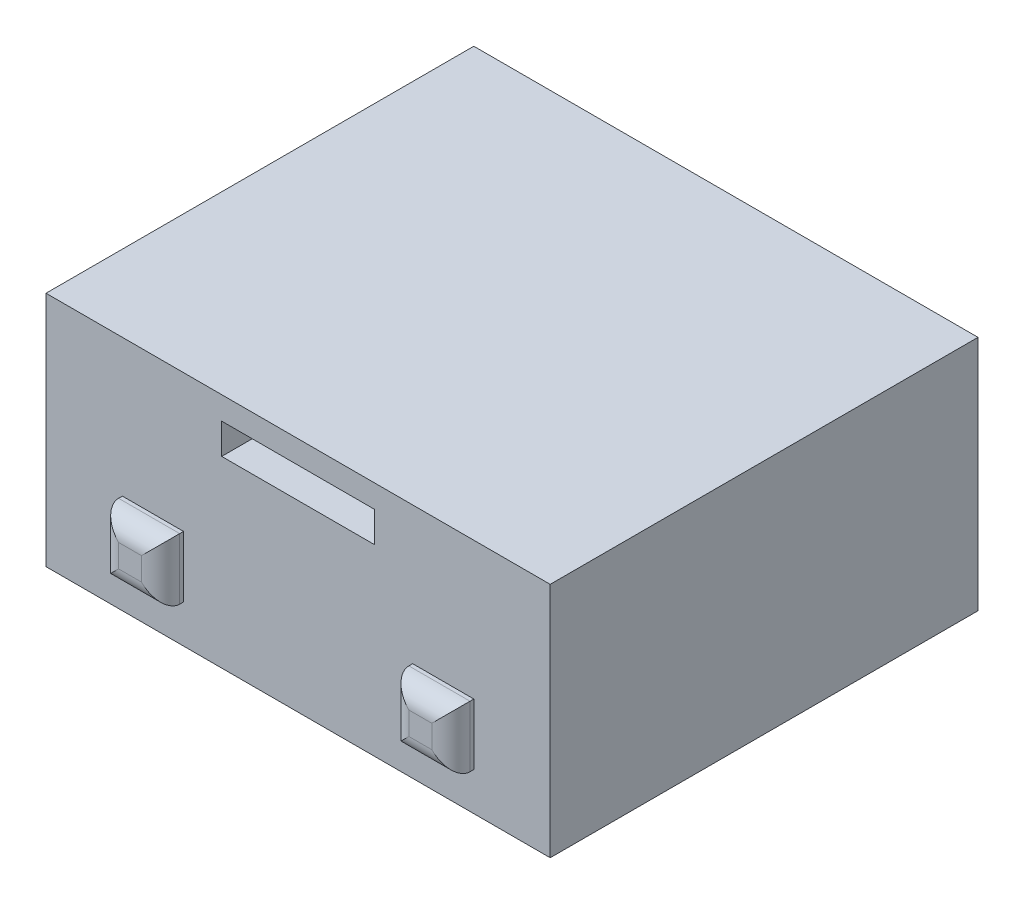
from build123d import *

# Parameters (mm, degrees)
SKETCH1_W            = 66
SKETCH1_H            = 56
BASE_DEPTH           = 3
SKETCH4_W            = 66
SKETCH4_H            = 56
SKETCH4_W_2          = 58
SKETCH4_H_2          = 48
WALL1_DEPTH          = 21
WALL2_START          = -21
SKETCH8_W            = 62
SKETCH8_H            = 52
SKETCH8_W_2          = 58
SKETCH8_H_2          = 48
WALL2_DEPTH          = 2
PCBWALL_START        = -3
SKETCH9_W            = 48
SKETCH9_H            = 38
SKETCH9_W_2          = 44
SKETCH9_H_2          = 34
PCBWALL_DEPTH        = 4
SKETCH10_R           = 1.2
MOUNTING_HOLE_DEPTH  = 4
SKETCH11_W           = 66
SKETCH11_H           = 56
EXTENDED_BASE_DEPTH  = 10
HEAD_START           = 28
SKETCH12_W           = 20
SKETCH12_H           = 4
HEAD_BAND_SLOT_DEPTH = 77.104053883
CLIPS_START          = 28
SKETCH13_W           = 8
SKETCH13_H           = 8
CLIPS_DEPTH          = 3
FILLET2_R            = 2.5


with BuildPart() as part:
    # Sketch1 → Base (new body)
    with BuildSketch(Plane(origin=(0, 0, 0), x_dir=(1, 0, 0), z_dir=(0, 1, 0))):
        Rectangle(SKETCH1_W, SKETCH1_H)
    extrude(amount=-BASE_DEPTH)

    # Sketch4 → Wall1 (add)
    with BuildSketch(Plane(origin=(0, 0, 0), x_dir=(1, 0, 0), z_dir=(0, 1, 0))):
        Rectangle(SKETCH4_W, SKETCH4_H)
        Rectangle(SKETCH4_W_2, SKETCH4_H_2, mode=Mode.SUBTRACT)
    extrude(amount=-WALL1_DEPTH)

    # Sketch8 → Wall2 (cut)
    with BuildSketch(Plane(origin=(0, 0, 0), x_dir=(1, 0, 0), z_dir=(0, 1, 0)).offset(WALL2_START)):
        Rectangle(SKETCH8_W, SKETCH8_H)
        Rectangle(SKETCH8_W_2, SKETCH8_H_2, mode=Mode.SUBTRACT)
    extrude(amount=WALL2_DEPTH, mode=Mode.SUBTRACT)

    # Sketch9 → PCBWall (add)
    with BuildSketch(Plane(origin=(0, 0, 0), x_dir=(1, 0, 0), z_dir=(0, 1, 0)).offset(PCBWALL_START)):
        Rectangle(SKETCH9_W, SKETCH9_H)
        Rectangle(SKETCH9_W_2, SKETCH9_H_2, mode=Mode.SUBTRACT)
    extrude(amount=-PCBWALL_DEPTH)

    # Sketch10 → Mounting hole (cut)
    with BuildSketch(Plane(origin=(0, 0, 0), x_dir=(1, 0, 0), z_dir=(0, 1, 0))):
        with Locations(Location((14.7, 13.1, 0), (0, 0, 270))):
            Circle(SKETCH10_R)
    extrude(amount=-MOUNTING_HOLE_DEPTH, mode=Mode.SUBTRACT)

    # Sketch11 → Extended Base (add)
    with BuildSketch(Plane(origin=(0, 0, 0), x_dir=(1, 0, 0), z_dir=(0, 1, 0))):
        Rectangle(SKETCH11_W, SKETCH11_H)
    extrude(amount=EXTENDED_BASE_DEPTH)

    # Sketch12 → Head Band Slot (cut, through all)
    with BuildSketch(Plane.XY.offset(HEAD_START)):
        with Locations((0, 5)):
            Rectangle(SKETCH12_W, SKETCH12_H)
    extrude(amount=-HEAD_BAND_SLOT_DEPTH, mode=Mode.SUBTRACT)

    # Sketch13 → Clips (add)
    with BuildSketch(Plane.XY.offset(CLIPS_START)):
        with Locations((-19, -12)):
            Rectangle(SKETCH13_W, SKETCH13_H)
        with Locations((19, -12)):
            Rectangle(SKETCH13_W, SKETCH13_H)
    clips = extrude(amount=CLIPS_DEPTH)

    # Clips2: Clips across plane
    add(clips.mirror(Plane.XY))

    # Fillet2
    fillet2_edges = [part.edges().sort_by_distance(p)[0] for p in [
        (-23, -12, 31),
        (-19, -16, 31),
        (-15, -12, 31),
        (-19, -8, 31),
        (15, -12, 31),
        (19, -16, 31),
        (23, -12, 31),
        (19, -8, 31),
        (15, -12, -31),
        (19, -8, -31),
        (23, -12, -31),
        (19, -16, -31),
        (-23, -12, -31),
        (-19, -8, -31),
        (-15, -12, -31),
        (-19, -16, -31),
    ]]
    fillet(fillet2_edges, radius=FILLET2_R)


solid = part.part
